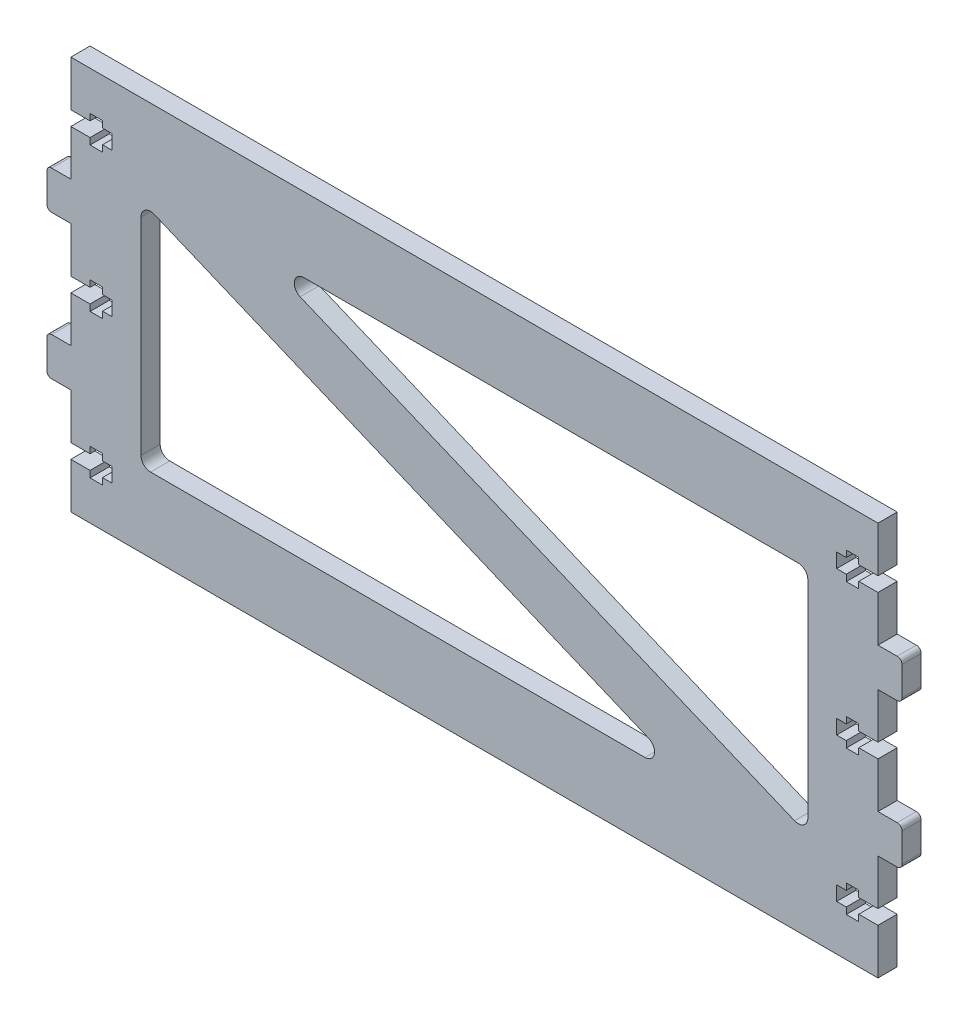
from build123d import *

# Parameters (mm, degrees)
EXTRUDE_1_DEPTH     = 4
CUT_EXTRUDE_1_DEPTH = 10
FILLET_1_R          = 1


with BuildPart() as part:
    # 草图1 → 凸台-拉伸1 (new body)
    with BuildSketch(Plane.XY):
        Polygon((72.534285714, 6.73), (76.534285714, 6.73), (76.534285714, 16.23), (81.534285714, 16.23), (81.534285714, 24.23), (76.534285714, 24.23), (76.534285714, 33.73), (72.534285714, 33.73), (72.534285714, 32.38), (69.934285714, 32.38), (69.934285714, 33.73), (67.934285714, 33.73), (67.934285714, 36.73), (69.934285714, 36.73), (69.934285714, 38.08), (72.534285714, 38.08), (72.534285714, 36.73), (76.534285714, 36.73), (76.534285714, 46.23), (54.534285714, 46.23), (-91.465714286, 46.23), (-91.465714286, 36.73), (-87.465714286, 36.73), (-87.465714286, 38.08), (-84.865714286, 38.08), (-84.865714286, 36.73), (-82.865714286, 36.73), (-82.865714286, 33.73), (-84.865714286, 33.73), (-84.865714286, 32.38), (-87.465714286, 32.38), (-87.465714286, 33.73), (-91.465714286, 33.73), (-91.465714286, 24.23), (-96.465714286, 24.23), (-96.465714286, 16.23), (-91.465714286, 16.23), (-91.465714286, 6.73), (-87.465714286, 6.73), (-87.465714286, 8.08), (-84.865714286, 8.08), (-84.865714286, 6.73), (-82.865714286, 6.73), (-82.865714286, 3.73), (-84.865714286, 3.73), (-84.865714286, 2.38), (-87.465714286, 2.38), (-87.465714286, 3.73), (-91.465714286, 3.73), (-91.465714286, -5.77), (-96.465714286, -5.77), (-96.465714286, -13.77), (-91.465714286, -13.77), (-91.465714286, -23.27), (-87.465714286, -23.27), (-87.465714286, -21.92), (-84.865714286, -21.92), (-84.865714286, -23.27), (-82.865714286, -23.27), (-82.865714286, -26.27), (-84.865714286, -26.27), (-84.865714286, -27.62), (-87.465714286, -27.62), (-87.465714286, -26.27), (-91.465714286, -26.27), (-91.465714286, -35.77), (54.534285714, -35.77), (76.534285714, -35.77), (76.534285714, -26.27), (72.534285714, -26.27), (72.534285714, -27.62), (69.934285714, -27.62), (69.934285714, -26.27), (67.934285714, -26.27), (67.934285714, -23.27), (69.934285714, -23.27), (69.934285714, -21.92), (72.534285714, -21.92), (72.534285714, -23.27), (76.534285714, -23.27), (76.534285714, -13.77), (81.534285714, -13.77), (81.534285714, -5.77), (76.534285714, -5.77), (76.534285714, 3.73), (72.534285714, 3.73), (72.534285714, 2.38), (69.934285714, 2.38), (69.934285714, 3.73), (67.934285714, 3.73), (67.934285714, 6.73), (69.934285714, 6.73), (69.934285714, 8.08), (72.534285714, 8.08), align=None)
    extrude(amount=EXTRUDE_1_DEPTH)

    # 草图3 → 切除-拉伸1 (cut)
    with BuildSketch(Plane.XY.offset(4)):
        with BuildLine():
            Line((28.802924928, -16.42457109), (-74.094745974, 26.563182669))
            ThreePointArc((-74.094745974, 26.563182669), (-75.974331302, 26.382376332), (-76.865714286, 24.717753759))
            Line((-76.865714286, 24.717753759), (-76.865714286, -18.27))
            ThreePointArc((-76.865714286, -18.27), (-76.279927848, -19.684213562), (-74.865714286, -20.27))
            Line((-74.865714286, -20.27), (28.031956617, -20.27))
            ThreePointArc((28.031956617, -20.27), (29.992933136, -18.6631553), (28.802924928, -16.42457109))
        make_face()
        with BuildLine():
            Line((-42.963385188, 30.73), (59.934285714, 30.73))
            ThreePointArc((59.934285714, 30.73), (61.348499277, 30.144213562), (61.934285714, 28.73))
            Line((61.934285714, 28.73), (61.934285714, -14.257753759))
            ThreePointArc((61.934285714, -14.257753759), (61.042902731, -15.922376332), (59.163317403, -16.103182669))
            Line((59.163317403, -16.103182669), (-43.7343535, 26.88457109))
            ThreePointArc((-43.7343535, 26.88457109), (-44.924361708, 29.1231553), (-42.963385188, 30.73))
        make_face()
    extrude(amount=-CUT_EXTRUDE_1_DEPTH, mode=Mode.SUBTRACT)

    # 圆角1
    fillet_1_edges = [part.edges().sort_by_distance(p)[0] for p in [
        (-96.465714286, -13.77, 2),
        (-96.465714286, -5.77, 2),
        (-96.465714286, 16.23, 2),
        (-96.465714286, 24.23, 2),
        (81.534285714, 24.23, 2),
        (81.534285714, 16.23, 2),
        (81.534285714, -5.77, 2),
        (81.534285714, -13.77, 2),
    ]]
    fillet(fillet_1_edges, radius=FILLET_1_R)


solid = part.part
